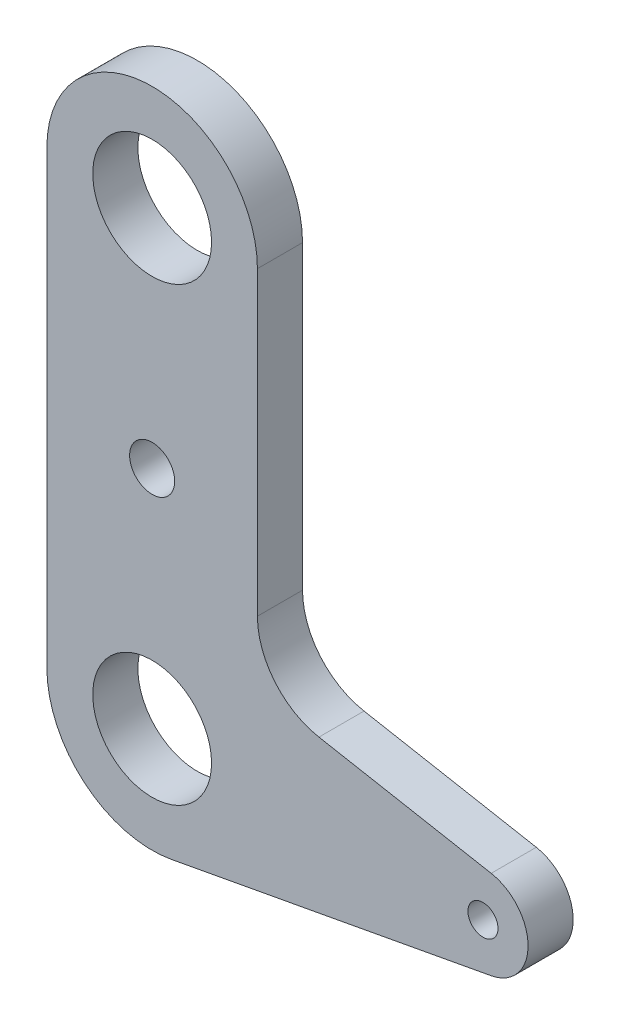
from build123d import *

# Parameters (mm, degrees)
SKETCH_1_R      = 3.95
SKETCH_1_R_2    = 1.5
SKETCH_1_R_3    = 1
EXTRUDE_1_DEPTH = 3
FILLET_1_R      = 5


with BuildPart() as part:
    # 草图1 → 凸台-拉伸1 (new body)
    with BuildSketch(Plane.XY):
        with BuildLine():
            Line((7, 5.82435206), (7, 30))
            ThreePointArc((7, 30), (0, 37), (-7, 30))
            Line((-7, 30), (-7, 0))
            ThreePointArc((-7, 0), (-4.477215043, -5.380942804), (1.272727273, -6.883325162))
            Line((1.272727273, -6.883325162), (22.545454545, -2.949996498))
            ThreePointArc((22.545454545, -2.949996498), (25, 0), (22.545454545, 2.949996498))
            Line((22.545454545, 2.949996498), (7, 5.82435206))
        make_face()
        Circle(SKETCH_1_R, mode=Mode.SUBTRACT)
        with Locations((0, 15)):
            Circle(SKETCH_1_R_2, mode=Mode.SUBTRACT)
        with Locations((0, 30)):
            Circle(SKETCH_1_R, mode=Mode.SUBTRACT)
        with Locations((22, 0)):
            Circle(SKETCH_1_R_3, mode=Mode.SUBTRACT)
    extrude(amount=EXTRUDE_1_DEPTH)

    # 圆角1
    fillet_1_edges = [part.edges().sort_by_distance(p)[0] for p in [
        (7, 5.82435206, 1.5),
    ]]
    fillet(fillet_1_edges, radius=FILLET_1_R)


solid = part.part
